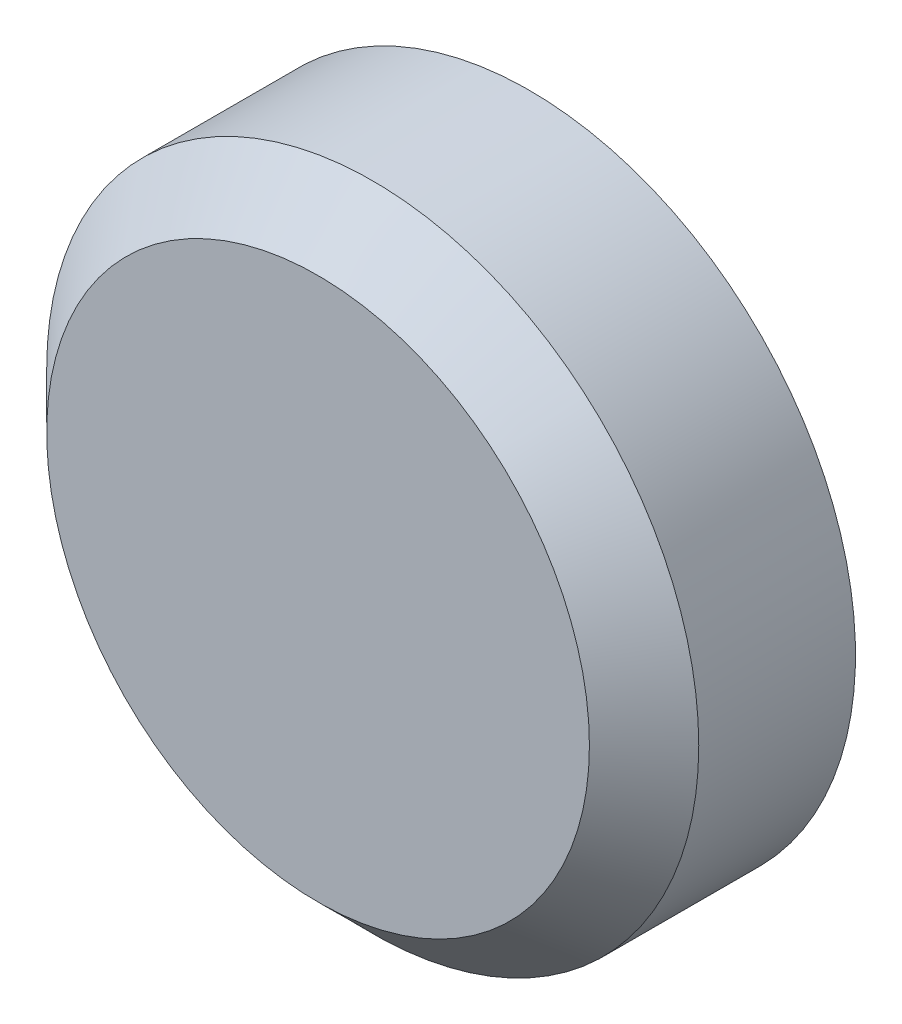
from build123d import *

# Parameters (mm, degrees)
SKETCH1_R           = 89.45
SKETCH1_R_2         = 76.75
BOSS_EXTRUDE1_DEPTH = 33
BOSS_EXTRUDE2_START = 5
SKETCH2_R           = 89.45
SKETCH2_R_2         = 85
BOSS_EXTRUDE2_DEPTH = 5
SKETCH3_R           = 89.45
BOSS_EXTRUDE3_DEPTH = 20
CHAMFER1_SIZE       = 15
CHAMFER2_SIZE       = 5
CHAMFER2_SIZE2      = 1.819851171
FILLET1_R           = 10
FILLET2_R           = 2
FILLET3_R           = 5


with BuildPart() as part:
    # Sketch1 → Boss-Extrude1 (new body)
    with BuildSketch(Plane.XY):
        Circle(SKETCH1_R)
        Circle(SKETCH1_R_2, mode=Mode.SUBTRACT)
    extrude(amount=BOSS_EXTRUDE1_DEPTH)

    # Sketch2 → Boss-Extrude2 (add)
    with BuildSketch(Plane(origin=(0, 0, 0), x_dir=(-1, 0, 0), z_dir=(0, 0, -1)).offset(BOSS_EXTRUDE2_START)):
        Circle(SKETCH2_R)
        Circle(SKETCH2_R_2, mode=Mode.SUBTRACT)
    extrude(amount=-BOSS_EXTRUDE2_DEPTH)

    # Sketch3 → Boss-Extrude3 (add)
    with BuildSketch(Plane.XY.offset(33)):
        with Locations(Location((0, 0, 0), (0, 0, 180))):
            Circle(SKETCH3_R)
    extrude(amount=BOSS_EXTRUDE3_DEPTH)

    # Chamfer1
    chamfer1_edges = [part.edges().sort_by_distance(p)[0] for p in [
        (89.45, 0, 53),
    ]]
    chamfer(chamfer1_edges, length=CHAMFER1_SIZE)

    # Chamfer2
    chamfer2_edges = [part.edges().sort_by_distance(p)[0] for p in [
        (-76.75, 0, 0),
    ]]
    chamfer2_side = [part.faces().sort_by_distance(p)[0] for p in [
        (-76.75, 0, 16.5),
    ]]
    chamfer(chamfer2_edges, length=CHAMFER2_SIZE, length2=CHAMFER2_SIZE2, reference=chamfer2_side[0])

    # Fillet1
    fillet1_edges = [part.edges().sort_by_distance(p)[0] for p in [
        (-76.75, 0, 5),
    ]]
    fillet(fillet1_edges, radius=FILLET1_R)

    # Fillet2
    fillet2_edges = [part.edges().sort_by_distance(p)[0] for p in [
        (-78.569851171, 0, 0),
    ]]
    fillet(fillet2_edges, radius=FILLET2_R)

    # Fillet3
    fillet3_edges = [part.edges().sort_by_distance(p)[0] for p in [
        (-76.75, 0, 33),
    ]]
    fillet(fillet3_edges, radius=FILLET3_R)


solid = part.part
